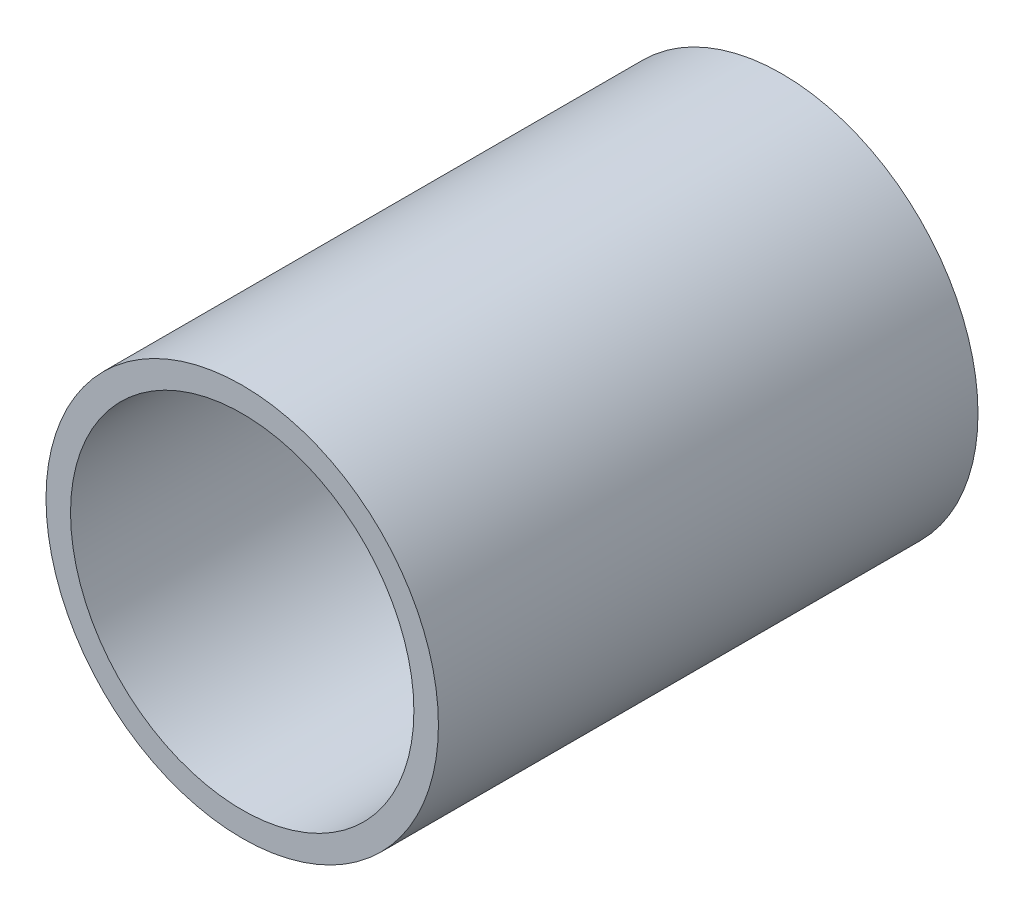
from build123d import *

# Parameters (mm, degrees)
SKETCH2_R           = 40
BOSS_EXTRUDE1_DEPTH = 110
SKETCH3_R           = 35
CUT_EXTRUDE1_DEPTH  = 110


with BuildPart() as part:
    # Sketch2 → Boss-Extrude1 (new body)
    with BuildSketch(Plane.XY):
        Circle(SKETCH2_R)
    extrude(amount=BOSS_EXTRUDE1_DEPTH)

    # Sketch3 → Cut-Extrude1 (cut)
    with BuildSketch(Plane.XY.offset(110)):
        Circle(SKETCH3_R)
    extrude(amount=-CUT_EXTRUDE1_DEPTH, mode=Mode.SUBTRACT)


solid = part.part
